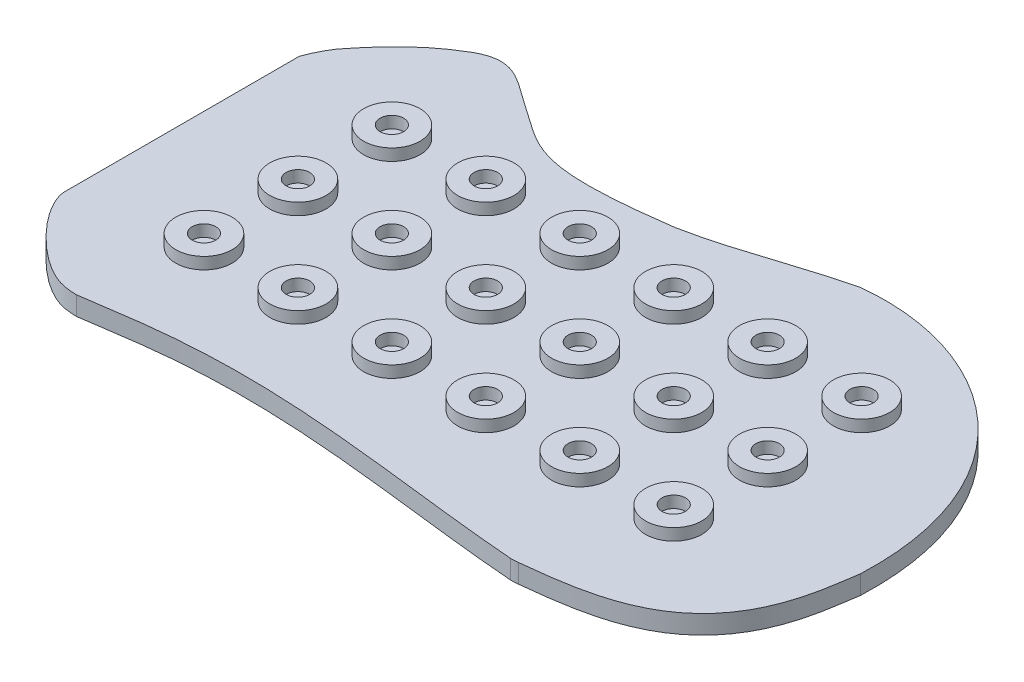
from build123d import *

# Parameters (mm, degrees)
BOSS_EXTRUDE2_DEPTH  = 4
SKETCH2_R            = 6
BOSS_EXTRUDE3_DEPTH  = 2.5
SKETCH4_R            = 2.5
CUT_EXTRUDE1_DEPTH   = 2.5
LPATTERN1_COUNT      = 3
LPATTERN1_PITCH      = 20
LPATTERN1_COUNT_DIR2 = 6
LPATTERN1_PITCH_DIR2 = 20


with BuildPart() as part:
    # Sketch1 → Boss-Extrude2 (new body)
    with BuildSketch(Plane(origin=(0, 0, 0), x_dir=(1, 0, 0), z_dir=(0, 1, 0))):
        with BuildLine():
            Line((-77.610928287, 24.73480995), (-77.610926739, -10.995486899))
            Line((-77.610926739, -10.995486899), (77.512336703, -10.995486899))
            add(Edge.make_bspline(
                [(77.512336703, -10.995486899), (77.518560385, -10.957874405), (77.524814965, -10.920112686), (77.531107112, -10.882121857)],
                knots=[1.010486637, 1.010486637, 1.010486637, 1.010486637, 1.01412385, 1.01412385, 1.01412385, 1.01412385], degree=3))
            add(Edge.make_bspline(
                [(77.531107112, -10.882121857), (77.574839436, -9.766511083), (77.609892635, -7.507402328), (77.488817492, -4.272864758), (77.205757806, -1.125162749), (76.619514408, 2.937285367), (75.50877626, 7.753752623), (72.989524017, 14.905909338), (68.566776195, 22.780014071), (61.595696469, 30.463398286), (53.335691478, 36.314584962), (44.158321293, 40.264828436), (34.449835996, 42.250559646), (27.85746121, 42.205857253), (24.60638519, 41.843406408)],
                knots=[0.000169226, 0.000169226, 0.000169226, 0.000169226, 0.031413574, 0.062657922, 0.09390227, 0.125146618, 0.187635314, 0.25012401, 0.375101401, 0.500078793, 0.625056185, 0.750033577, 0.875010969, 0.999988361, 0.999988361, 0.999988361, 0.999988361], degree=3))
            add(Edge.make_bspline(
                [(24.60638519, 41.843406408), (19.441654305, 40.599557497), (11.868641969, 38.10186056), (1.706905963, 34.941445063), (-3.490903085, 33.661503777), (-6.113060784, 33.160531214)],
                knots=[0.000658959, 0.000658959, 0.000658959, 0.000658959, 0.498067368, 0.746771573, 0.995475778, 0.995475778, 0.995475778, 0.995475778], degree=3))
            add(Edge.make_bspline(
                [(-6.113060784, 33.160531214), (-7.141691771, 33.016316508), (-9.182526978, 32.742024746), (-13.41706461, 32.236967498), (-18.636406478, 31.76535684), (-24.35525076, 31.602322531), (-29.284430774, 31.960023989), (-33.420361612, 32.921566077), (-36.371506688, 34.261606006), (-38.649706949, 35.648097323), (-40.392953753, 36.835956096), (-41.960752384, 37.950009586), (-43.317594841, 38.899351268), (-44.070083407, 39.410677407), (-44.439121999, 39.658722592)],
                knots=[-0.00019559, -0.00019559, -0.00019559, -0.00019559, 0.062587211, 0.125370012, 0.250935613, 0.376501215, 0.502066816, 0.627632417, 0.753198019, 0.81598082, 0.87876362, 0.941546421, 0.972937821, 1.004329222, 1.004329222, 1.004329222, 1.004329222], degree=3))
            add(Edge.make_bspline(
                [(-44.439121999, 39.658722592), (-44.698278493, 39.837478936), (-45.221943057, 40.202686415), (-46.204449693, 40.903278583), (-47.345032131, 41.729218311), (-48.599765224, 42.619793879), (-50.15090873, 43.651280208), (-51.914572875, 44.618913698), (-53.861511808, 45.22944075), (-55.705524128, 45.327541985), (-57.164765963, 45.050979151), (-58.248551256, 44.683932663), (-59.000335406, 44.361625817), (-59.68368912, 44.01293032), (-60.037538284, 43.806100934), (-60.223947924, 43.693990747)],
                knots=[-0.002497219, -0.002497219, -0.002497219, -0.002497219, 0.029065652, 0.060628523, 0.123754265, 0.186880007, 0.250005749, 0.376257234, 0.502508718, 0.628760202, 0.755011687, 0.818137429, 0.881263171, 0.944388913, 1.007514655, 1.007514655, 1.007514655, 1.007514655], degree=3))
            add(Edge.make_bspline(
                [(-60.223947924, 43.693990747), (-60.647418813, 43.446259773), (-61.492438659, 42.931359573), (-63.090560833, 41.877343183), (-65.712449046, 39.946479206), (-68.970886279, 37.019932698), (-71.698068002, 34.035828956), (-73.643714468, 31.694824796), (-74.523586793, 30.588052824), (-74.969576783, 30.022283972)],
                knots=[0.000174078, 0.000174078, 0.000174078, 0.000174078, 0.062881444, 0.12558881, 0.251003541, 0.501833004, 0.752662466, 0.878077198, 1.003491929, 1.003491929, 1.003491929, 1.003491929], degree=3))
            add(Edge.make_bspline(
                [(-74.969576783, 30.022283972), (-75.519545883, 29.19186114), (-76.530249869, 27.448037515), (-77.287396087, 25.657695857), (-77.610928287, 24.73480995)],
                knots=[0.499549048, 0.499549048, 0.499549048, 0.499549048, 0.499765799, 0.49998255, 0.49998255, 0.49998255, 0.49998255], degree=3))
        make_face()
        with BuildLine():
            Line((77.512336703, -10.995486899), (-77.610926739, -10.995486899))
            Line((-77.610926739, -10.995486899), (-77.610926696, -11.995486899))
            Line((-77.610926696, -11.995486899), (77.352572442, -11.995486899))
            add(Edge.make_bspline(
                [(77.352572442, -11.995486899), (77.358645684, -11.955275612), (77.412259186, -11.602816601), (77.464316371, -11.285695229), (77.512336703, -10.995486899)],
                knots=[0.978851886, 0.978851886, 0.978851886, 0.978851886, 0.982422834, 1.010486637, 1.010486637, 1.010486637, 1.010486637], degree=3))
        make_face()
        with BuildLine():
            Line((77.352572442, -11.995486899), (-77.610926696, -11.995486899))
            Line((-77.610926696, -11.995486899), (-77.610926126, -25.14203309))
            add(Edge.make_bspline(
                [(-77.610926126, -25.14203309), (-77.610329581, -25.399956565), (-77.56299042, -25.903042711), (-77.289715127, -26.985745976), (-76.641681648, -28.530602527), (-75.497775654, -30.448110961), (-73.605831916, -33.039049782), (-70.803315368, -36.111993436), (-67.327412016, -39.127002194), (-64.140223394, -41.243972104), (-61.455644843, -42.436069514), (-59.281170991, -42.877843858), (-58.025592683, -42.909198362), (-57.3728408, -42.946603583)],
                knots=[0.000484301, 0.000484301, 0.000484301, 0.000484301, 0.031521334, 0.062558366, 0.124632431, 0.186706496, 0.248780561, 0.37292869, 0.49707682, 0.62122495, 0.745373079, 0.869521209, 0.993669339, 0.993669339, 0.993669339, 0.993669339], degree=3))
            add(Edge.make_bspline(
                [(-57.3728408, -42.946603583), (-57.13064829, -42.917162583), (-56.655899826, -42.857244252), (-55.632891969, -42.716833971), (-54.283173397, -42.517569574), (-52.529691334, -42.248220025), (-50.028198289, -41.865201142), (-46.600250729, -41.367044153), (-42.036258597, -40.811127611), (-37.051373779, -40.355934431), (-29.881163552, -39.94286355), (-20.010895236, -39.876612938), (-6.937670032, -40.617368244), (4.79101559, -41.816338855), (14.569227449, -42.959318591), (22.067232439, -43.838869966), (29.700051426, -44.671831852), (34.887053568, -45.137323321), (37.472492496, -45.32880882)],
                knots=[0.000538145, 0.000538145, 0.000538145, 0.000538145, 0.016151963, 0.031765781, 0.062993416, 0.094221052, 0.125448688, 0.18790396, 0.250359232, 0.312814503, 0.375269775, 0.500180319, 0.625090862, 0.750001406, 0.812456678, 0.874911949, 0.937367221, 0.999822493, 0.999822493, 0.999822493, 0.999822493], degree=3))
            ThreePointArc((37.472492496, -45.32880882), (38.248733412, -45.324262341), (39.021479233, -45.250543112))
            add(Edge.make_bspline(
                [(39.021479233, -45.250543112), (40.554063275, -45.087269156), (43.636191946, -44.744534775), (49.629747374, -43.872748427), (56.64310661, -42.215757501), (63.76459646, -38.913707507), (69.322535256, -34.215518596), (72.595951354, -29.308690908), (74.463908277, -25.056718438), (75.526739474, -21.803040338), (76.297079472, -18.602211114), (76.745734786, -16.093857572), (77.025988143, -14.25776708), (77.200159766, -13.042150967), (77.304730613, -12.312250405), (77.352572442, -11.995486899)],
                knots=[-0.000308659, -0.000308659, -0.000308659, -0.000308659, 0.063093373, 0.126495404, 0.253299468, 0.380103532, 0.506907596, 0.633711659, 0.697113691, 0.760515723, 0.823917755, 0.887319787, 0.919020803, 0.950721818, 0.978851886, 0.978851886, 0.978851886, 0.978851886], degree=3))
        make_face()
    extrude(amount=BOSS_EXTRUDE2_DEPTH)

    # Sketch2 → Boss-Extrude3 (add)
    with BuildSketch(Plane(origin=(0, 4, 0), x_dir=(1, 0, 0), z_dir=(0, 1, 0))):
        with Locations(Location((-52.601285046, 19.444993701, 0), (0, 0, 270))):
            Circle(SKETCH2_R)
    boss_extrude3 = extrude(amount=BOSS_EXTRUDE3_DEPTH)

    # Sketch4 → Cut-Extrude1 (cut)
    with BuildSketch(Plane(origin=(0, 6.5, 0), x_dir=(1, 0, 0), z_dir=(0, 1, 0))):
        with Locations(Location((-52.601285046, 19.444993701, 0), (0, 0, 270))):
            Circle(SKETCH4_R)
    cut_extrude1 = extrude(amount=-CUT_EXTRUDE1_DEPTH, mode=Mode.SUBTRACT)

    # LPattern1: Boss-Extrude3, Cut-Extrude1 3 × 6
    with Locations(*[(j * LPATTERN1_PITCH_DIR2, 0, i * LPATTERN1_PITCH) for i in range(LPATTERN1_COUNT) for j in range(LPATTERN1_COUNT_DIR2) if (i, j) != (0, 0)]):
        add(boss_extrude3)
        add(cut_extrude1, mode=Mode.SUBTRACT)


solid = part.part
